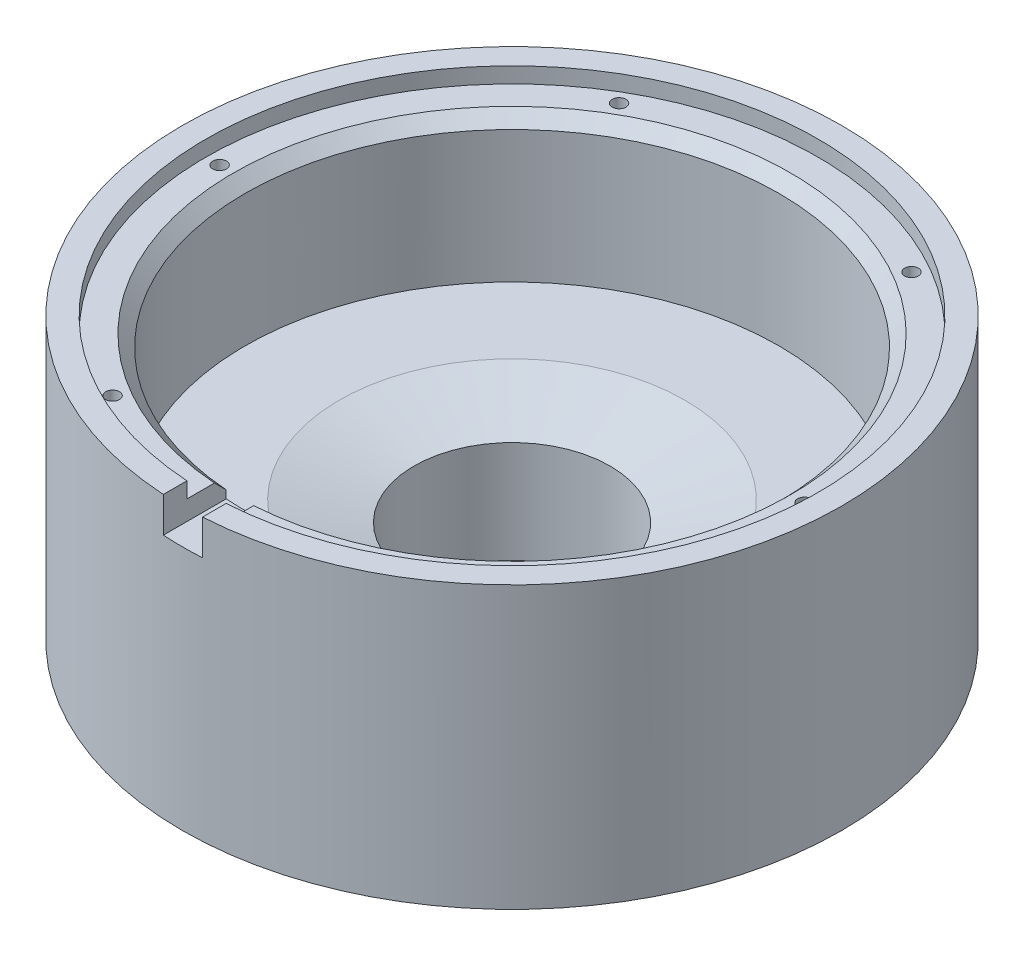
from build123d import *

# Parameters (mm, degrees)
SKETCH8_W         = 5
SKETCH8_H         = 8.09193466
WIRE_HOLE_DEPTH   = 4.5
CHAMFER1_SIZE     = 1.5
SKETCH9_R         = 0.875
FRONT_HOLES_DEPTH = 6
SKETCH10_R        = 2.875
BACK_HOLES_DEPTH  = 8


with BuildPart() as part:
    # Sketch7 → Base Motor Housing (revolve)
    with BuildSketch(Plane.XY, mode=Mode.PRIVATE) as base_motor_housing_sk:
        Polygon((-42.0375, 21.59), (-39.0375, 21.59), (-39.0375, 19.59), (-34.0375, 19.59), (-34.0375, 1.25), (-22.0375, 1.25), (-12.5, -1.25), (-12.5, -14.25), (-42.0375, -14.25), align=None)
    revolve(base_motor_housing_sk.sketch.rotate(Axis((0, -30.231871117, 0), (0, 1, 0)), 270), axis=Axis((0, -30.231871117, 0), (0, 1, 0)))

    # Sketch8 → Wire Hole (cut)
    with BuildSketch(Plane(origin=(0, 21.59, 0), x_dir=(1, 0, 0), z_dir=(0, 1, 0))):
        with Locations((0, -37.99153267)):
            Rectangle(SKETCH8_W, SKETCH8_H)
    extrude(amount=-WIRE_HOLE_DEPTH, mode=Mode.SUBTRACT)

    # Chamfer1
    chamfer1_edges = [part.edges().sort_by_distance(p)[0] for p in [
        (34.01450857, 19.59, -1.250844913),
    ]]
    chamfer(chamfer1_edges, length=CHAMFER1_SIZE)

    # Sketch9 → Front-Holes (cut)
    with BuildSketch(Plane(origin=(0, 19.59, 0), x_dir=(1, 0, 0), z_dir=(0, 1, 0))):
        with Locations(Location((-37.2875, 0, 0), (0, 0, 270))):
            Circle(SKETCH9_R)
        with Locations(Location((-18.64375, 32.291922244, 0), (0, 0, 270))):
            Circle(SKETCH9_R)
        with Locations(Location((18.64375, 32.291922244, 0), (0, 0, 270))):
            Circle(SKETCH9_R)
        with Locations(Location((37.2875, 0, 0), (0, 0, 270))):
            Circle(SKETCH9_R)
        with Locations(Location((18.64375, -32.291922244, 0), (0, 0, 270))):
            Circle(SKETCH9_R)
        with Locations(Location((-18.64375, -32.291922244, 0), (0, 0, 270))):
            Circle(SKETCH9_R)
    extrude(amount=-FRONT_HOLES_DEPTH, mode=Mode.SUBTRACT)

    # Sketch10 → Back-Holes (cut)
    with BuildSketch(Plane.XZ.offset(14.25)):
        with Locations(Location((-27.26875, 0, 0), (0, 0, 270))):
            Circle(SKETCH10_R)
        with Locations(Location((-13.634375, 23.615430229, 0), (0, 0, 270))):
            Circle(SKETCH10_R)
        with Locations(Location((13.634375, 23.615430229, 0), (0, 0, 270))):
            Circle(SKETCH10_R)
        with Locations(Location((27.26875, 0, 0), (0, 0, 270))):
            Circle(SKETCH10_R)
        with Locations(Location((13.634375, -23.615430229, 0), (0, 0, 270))):
            Circle(SKETCH10_R)
        with Locations(Location((-13.634375, -23.615430229, 0), (0, 0, 270))):
            Circle(SKETCH10_R)
    extrude(amount=-BACK_HOLES_DEPTH, mode=Mode.SUBTRACT)


solid = part.part
